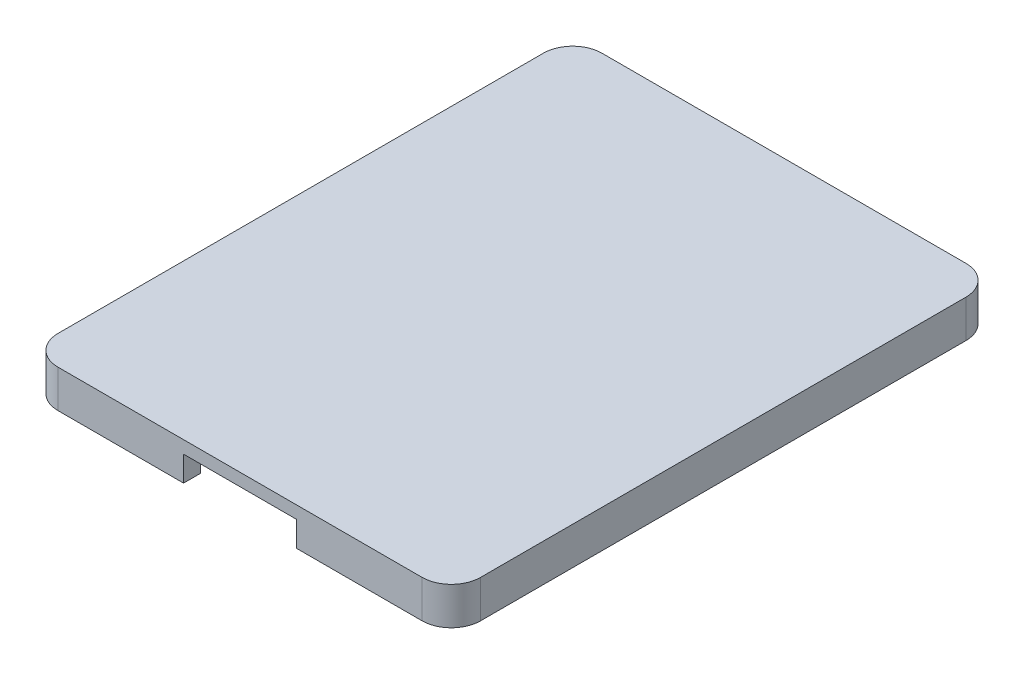
from build123d import *

# Parameters (mm, degrees)
BOSS_EXTRUDE1_DEPTH = 4.5
CUT_EXTRUDE1_DEPTH  = 4
SKETCH3_W           = 13.5
SKETCH3_H           = 6
CUT_EXTRUDE2_DEPTH  = 15


with BuildPart() as part:
    # Sketch1 → Boss-Extrude1 (new body)
    with BuildSketch(Plane(origin=(0, 0, 0), x_dir=(1, 0, 0), z_dir=(0, 1, 0))):
        with BuildLine():
            Line((-21.75, -32.5), (21.75, -32.5))
            ThreePointArc((21.75, -32.5), (24.224873734, -31.474873734), (25.25, -29))
            Line((25.25, -29), (25.25, 29))
            ThreePointArc((25.25, 29), (24.224873734, 31.474873734), (21.75, 32.5))
            Line((21.75, 32.5), (-21.75, 32.5))
            ThreePointArc((-21.75, 32.5), (-24.224873734, 31.474873734), (-25.25, 29))
            Line((-25.25, 29), (-25.25, -29))
            ThreePointArc((-25.25, -29), (-24.224873734, -31.474873734), (-21.75, -32.5))
        make_face()
    extrude(amount=BOSS_EXTRUDE1_DEPTH)

    # Sketch2 → Cut-Extrude1 (cut)
    with BuildSketch(Plane.XZ):
        with BuildLine():
            Line((-19.75, -30.5), (19.75, -30.5))
            ThreePointArc((19.75, -30.5), (22.224873734, -29.474873734), (23.25, -27))
            Line((23.25, -27), (23.25, 27))
            ThreePointArc((23.25, 27), (22.224873734, 29.474873734), (19.75, 30.5))
            Line((19.75, 30.5), (-19.75, 30.5))
            ThreePointArc((-19.75, 30.5), (-22.224873734, 29.474873734), (-23.25, 27))
            Line((-23.25, 27), (-23.25, -27))
            ThreePointArc((-23.25, -27), (-22.224873734, -29.474873734), (-19.75, -30.5))
        make_face()
    extrude(amount=-CUT_EXTRUDE1_DEPTH, mode=Mode.SUBTRACT)

    # Sketch3 → Cut-Extrude2 (cut)
    with BuildSketch(Plane.XY.offset(32.5)):
        Rectangle(SKETCH3_W, SKETCH3_H)
    extrude(amount=-CUT_EXTRUDE2_DEPTH, mode=Mode.SUBTRACT)


solid = part.part
